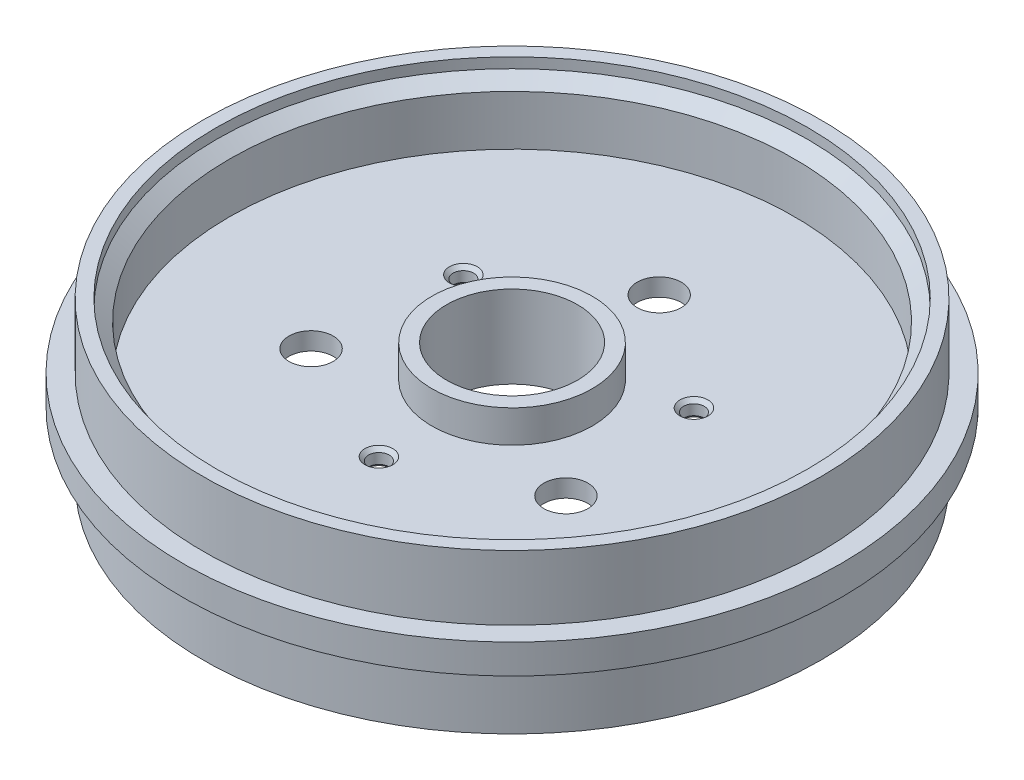
from build123d import *

# Parameters (mm, degrees)
SKETCH3_R          = 1.5
SKETCH3_R_2        = 0.7
CUT_EXTRUDE1_DEPTH = 1.2


with BuildPart() as part:
    # Sketch1 → Revolve1 (revolve)
    with BuildSketch(Plane.XY):
        Polygon((4.45, 0), (4.45, 2.8), (5.45, 2.8), (5.45, 0.6), (19.2, 0.6), (19.2, 4), (20.1, 4.7), (20.1, 5.4), (21, 5.4), (21, 1), (22.4, 1), (22.4, 0), align=None)
    revolve1 = revolve(axis=Axis((0, -5.4, 0), (0, 1, 0)))

    # Mirror1: Revolve1 across plane
    add(revolve1.mirror(Plane(origin=(22.4, 0, 0), x_dir=(0, 0, 1), z_dir=(0, -1, 0))))

    # Sketch3 → Cut-Extrude1 (cut)
    with BuildSketch(Plane(origin=(0, 0.6, 0), x_dir=(1, 0, 0), z_dir=(0, 1, 0))):
        with Locations(Location((0, 10, 0), (0, 0, 180))):
            Circle(SKETCH3_R)
        with Locations(Location((-8.660254038, -5, 0), (0, 0, 180))):
            Circle(SKETCH3_R)
        with Locations(Location((8.660254038, -5, 0), (0, 0, 180))):
            Circle(SKETCH3_R)
        with Locations(Location((-7.837529904, 4.525, 0), (0, 0, 180))):
            Circle(SKETCH3_R_2)
        with Locations(Location((7.837529904, 4.525, 0), (0, 0, 180))):
            Circle(SKETCH3_R_2)
        with Locations(Location((0, -9.05, 0), (0, 0, 180))):
            Circle(SKETCH3_R_2)
    extrude(amount=-CUT_EXTRUDE1_DEPTH, mode=Mode.SUBTRACT)

    # Cut-Extrude2 cone 1 section (through the dimple's axis) → Cut-Extrude2 (revolve, cut)
    with BuildSketch(Plane(origin=(0, 0.6, 9.05), x_dir=(0, 0, 1), z_dir=(1, 0, 0))):
        Polygon((0, 0), (0.95, 0), (0, 0.95), align=None)
    revolve(axis=Axis((0, 0.6, 9.05), (0, -1, 0)), mode=Mode.SUBTRACT)

    # Cut-Extrude2 cone 2 section (through the dimple's axis) → Cut-Extrude2 cone 2 (revolve, cut)
    with BuildSketch(Plane(origin=(7.837529904, 0.6, -4.525), x_dir=(0, 0, 1), z_dir=(1, 0, 0))):
        Polygon((0, 0), (0.95, 0), (0, 0.95), align=None)
    revolve(axis=Axis((7.837529904, 0.6, -4.525), (0, -1, 0)), mode=Mode.SUBTRACT)

    # Cut-Extrude2 cone 3 section (through the dimple's axis) → Cut-Extrude2 cone 3 (revolve, cut)
    with BuildSketch(Plane(origin=(-7.837529904, 0.6, -4.525), x_dir=(0, 0, 1), z_dir=(1, 0, 0))):
        Polygon((0, 0), (0.95, 0), (0, 0.95), align=None)
    revolve(axis=Axis((-7.837529904, 0.6, -4.525), (0, -1, 0)), mode=Mode.SUBTRACT)

    # Cut-Extrude3 cone 1 section (through the dimple's axis) → Cut-Extrude3 (revolve, cut)
    with BuildSketch(Plane(origin=(7.837529904, -0.6, -4.525), x_dir=(0, 0, -1), z_dir=(1, 0, 0))):
        Polygon((0, 0), (0.95, 0), (0, 0.95), align=None)
    revolve(axis=Axis((7.837529904, -0.6, -4.525), (0, 1, 0)), mode=Mode.SUBTRACT)

    # Cut-Extrude3 cone 2 section (through the dimple's axis) → Cut-Extrude3 cone 2 (revolve, cut)
    with BuildSketch(Plane(origin=(0, -0.6, 9.05), x_dir=(0, 0, -1), z_dir=(1, 0, 0))):
        Polygon((0, 0), (0.95, 0), (0, 0.95), align=None)
    revolve(axis=Axis((0, -0.6, 9.05), (0, 1, 0)), mode=Mode.SUBTRACT)

    # Cut-Extrude3 cone 3 section (through the dimple's axis) → Cut-Extrude3 cone 3 (revolve, cut)
    with BuildSketch(Plane(origin=(-7.837529904, -0.6, -4.525), x_dir=(0, 0, -1), z_dir=(1, 0, 0))):
        Polygon((0, 0), (0.95, 0), (0, 0.95), align=None)
    revolve(axis=Axis((-7.837529904, -0.6, -4.525), (0, 1, 0)), mode=Mode.SUBTRACT)


solid = part.part
